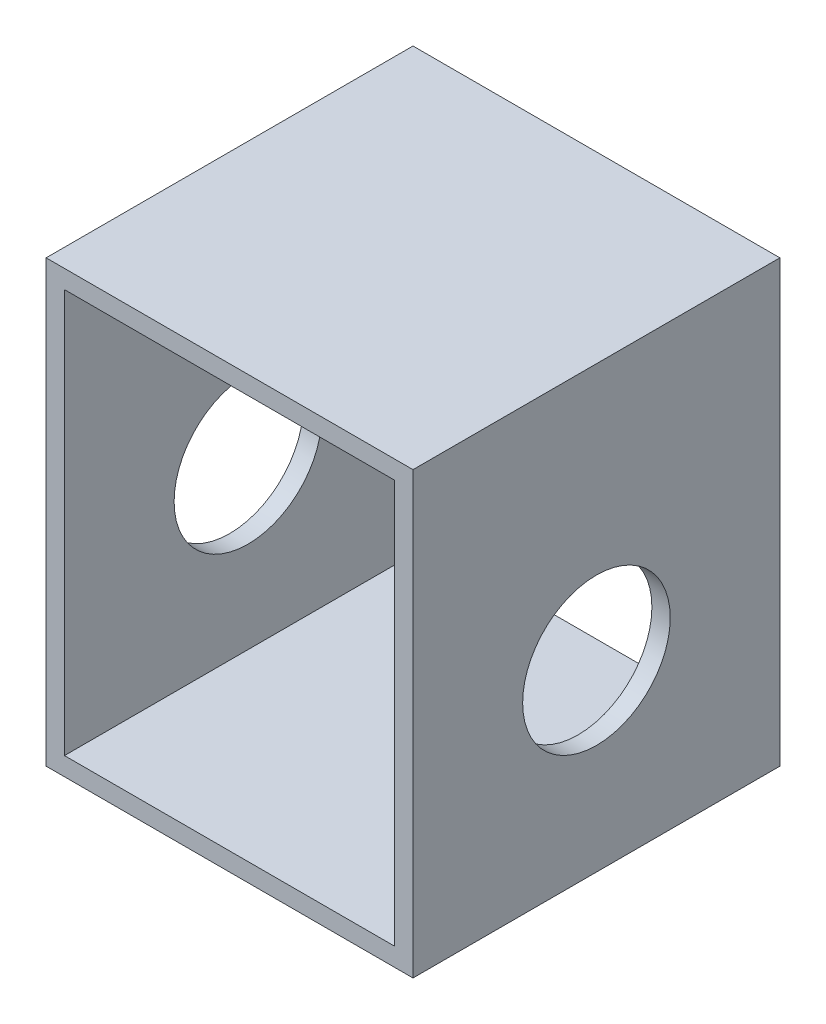
from build123d import *

# Parameters (mm, degrees)
SKETCH1_W           = 63.5
SKETCH1_H           = 76.2
SKETCH1_W_2         = 57.15
SKETCH1_H_2         = 69.85
BOSS_EXTRUDE1_DEPTH = 63.5
SKETCH2_R           = 12.772223226
CUT_EXTRUDE1_DEPTH  = 118.774954893


with BuildPart() as part:
    # Sketch1 → Boss-Extrude1 (new body)
    with BuildSketch(Plane.XY):
        with Locations((31.75, 38.1)):
            Rectangle(SKETCH1_W, SKETCH1_H)
        with Locations((31.75, 38.1)):
            Rectangle(SKETCH1_W_2, SKETCH1_H_2, mode=Mode.SUBTRACT)
    extrude(amount=BOSS_EXTRUDE1_DEPTH)

    # Sketch2 → Cut-Extrude1 (cut, through all)
    with BuildSketch(Plane.ZY):
        with Locations(Location((31.75, 31.75, 0), (0, 0, 270))):
            Circle(SKETCH2_R)
    extrude(amount=-CUT_EXTRUDE1_DEPTH, mode=Mode.SUBTRACT)


solid = part.part
